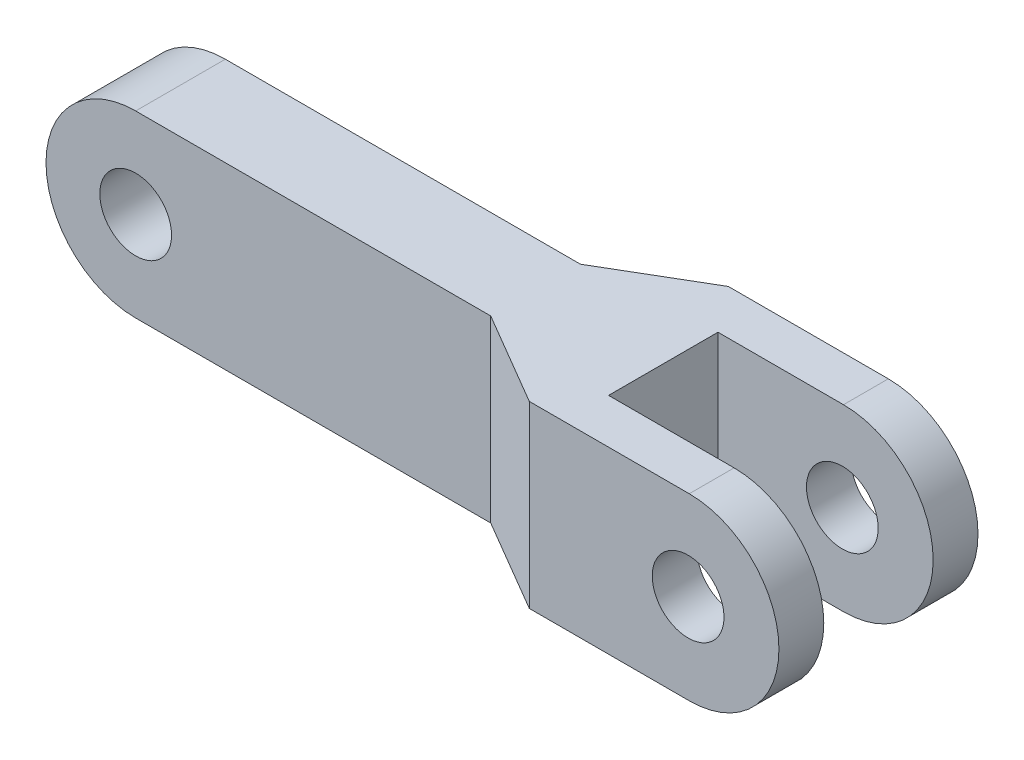
from build123d import *

# Parameters (mm, degrees)
ESQUISSE1_R             = 2
BOSS_EXTRU_1_DEPTH      = 5
ESQUISSE2_W             = 12
ESQUISSE2_H             = 2.5
BOSS_EXTRU_2_DEPTH      = 10
BOSS_EXTRU_2_2_DEPTH    = 10
ESQUISSE5_W             = 1.920676926
ESQUISSE5_H             = 10
BOSS_EXTRU_4_DEPTH      = 6.1
ESQUISSE7_W             = 2.5
ESQUISSE7_H             = 10
BOSS_EXTRU_6_DEPTH      = 1.920676926
CONG_4_RADIUS           = 5
CONG_4_LENGTH           = 2.5
BOSS_EXTRU_5_DEPTH      = 10
ESQUISSE4_R             = 2
ENL_V_MAT_EXTRU_2_DEPTH = 27.8404319
CONG_5_RADIUS           = 5
CONG_5_LENGTH           = 2.5


with BuildPart() as part:
    # Esquisse1 → Boss.-Extru.1 (new body)
    with BuildSketch(Plane.XY):
        with BuildLine():
            Line((-15, 5), (10, 5))
            Line((10, 5), (10, -5))
            Line((10, -5), (-15, -5))
            ThreePointArc((-15, -5), (-20, 0), (-15, 5))
        make_face()
        with Locations((-15, 0)):
            Circle(ESQUISSE1_R, mode=Mode.SUBTRACT)
    extrude(amount=BOSS_EXTRU_1_DEPTH)

    # Esquisse5 → Boss.-Extru.4 (add)
    with BuildSketch(Plane.XY.offset(-0.55)):
        with Locations((10.960338463, 0)):
            Rectangle(ESQUISSE5_W, ESQUISSE5_H)
    extrude(amount=BOSS_EXTRU_4_DEPTH)



with BuildPart() as body_2:
    # Esquisse2 → Boss.-Extru.2 (new, through all)
    with BuildSketch(Plane(origin=(0, 5, 0), x_dir=(1, 0, 0), z_dir=(0, 1, 0))):
        with Locations((17.920676926, 1.8)):
            Rectangle(ESQUISSE2_W, ESQUISSE2_H)
    extrude(amount=-BOSS_EXTRU_2_DEPTH)


with BuildPart() as body_3:
    # Esquisse2 → Boss.-Extru.2 2 (new, through all)
    with BuildSketch(Plane(origin=(0, 5, 0), x_dir=(1, 0, 0), z_dir=(0, 1, 0))):
        with Locations((17.920676926, -6.8)):
            Rectangle(ESQUISSE2_W, ESQUISSE2_H)
    extrude(amount=-BOSS_EXTRU_2_2_DEPTH)


with BuildPart() as part_1:
    add(part.part)

    add(body_2.part)  # Boss.-Extru.6 merges body 2

    add(body_3.part)  # Boss.-Extru.6 merges body 3
    # Esquisse7 → Boss.-Extru.6 (add)
    with BuildSketch(Plane.ZY.offset(-11.920676926)):
        with Locations((-1.8, 0)):
            Rectangle(ESQUISSE7_W, ESQUISSE7_H)
        with Locations((6.8, 0)):
            Rectangle(ESQUISSE7_W, ESQUISSE7_H)
    extrude(amount=BOSS_EXTRU_6_DEPTH)

    # Congé4: full round fillet: the end face becomes a half cylinder, R = half its width
    cong_4_face = Plane((23.920676926, 0, 6.8), x_dir=(0, 0, 1), z_dir=(1, 0, 0))  # on the end face: x along it, z out of the body
    cong_4_slab = cong_4_face.offset(-CONG_4_RADIUS / 2) * Box(CONG_4_LENGTH, 2 * CONG_4_RADIUS, CONG_4_RADIUS, mode=Mode.PRIVATE)  # the body's end, R deep
    cong_4_round = Plane((18.920676926, 0, 6.8), x_dir=(1, 0, 0), z_dir=(0, 0, 1)) * Cylinder(CONG_4_RADIUS, CONG_4_LENGTH, mode=Mode.PRIVATE)  # its axis R under the face
    add(cong_4_slab - cong_4_round, mode=Mode.SUBTRACT)

    # Esquisse6 → Boss.-Extru.5 (add, through all)
    with BuildSketch(Plane(origin=(0, 5, 0), x_dir=(1, 0, 0), z_dir=(0, 1, 0))):
        Polygon((10, 0), (10, 3.05), (4.799024164, 0), align=None)
        Polygon((4.799024164, -5), (10, -8.05), (10, -5), align=None)
    extrude(amount=-BOSS_EXTRU_5_DEPTH)

    # Esquisse4 → Enlèv. mat.-Extru.2 (cut, through all)
    with BuildSketch(Plane(origin=(0, 0, -3.05), x_dir=(-1, 0, 0), z_dir=(0, 0, -1))):
        with Locations((-18.856076392, 0)):
            Circle(ESQUISSE4_R)
    extrude(amount=-ENL_V_MAT_EXTRU_2_DEPTH, mode=Mode.SUBTRACT)

    # Congé5: full round fillet: the end face becomes a half cylinder, R = half its width
    cong_5_face = Plane((23.920676926, 0, -1.8), x_dir=(0, 0, -1), z_dir=(1, 0, 0))  # on the end face: x along it, z out of the body
    cong_5_slab = cong_5_face.offset(-CONG_5_RADIUS / 2) * Box(CONG_5_LENGTH, 2 * CONG_5_RADIUS, CONG_5_RADIUS, mode=Mode.PRIVATE)  # the body's end, R deep
    cong_5_round = Plane((18.920676926, 0, -1.8), x_dir=(1, 0, 0), z_dir=(0, 0, -1)) * Cylinder(CONG_5_RADIUS, CONG_5_LENGTH, mode=Mode.PRIVATE)  # its axis R under the face
    add(cong_5_slab - cong_5_round, mode=Mode.SUBTRACT)


solid = part_1.part
